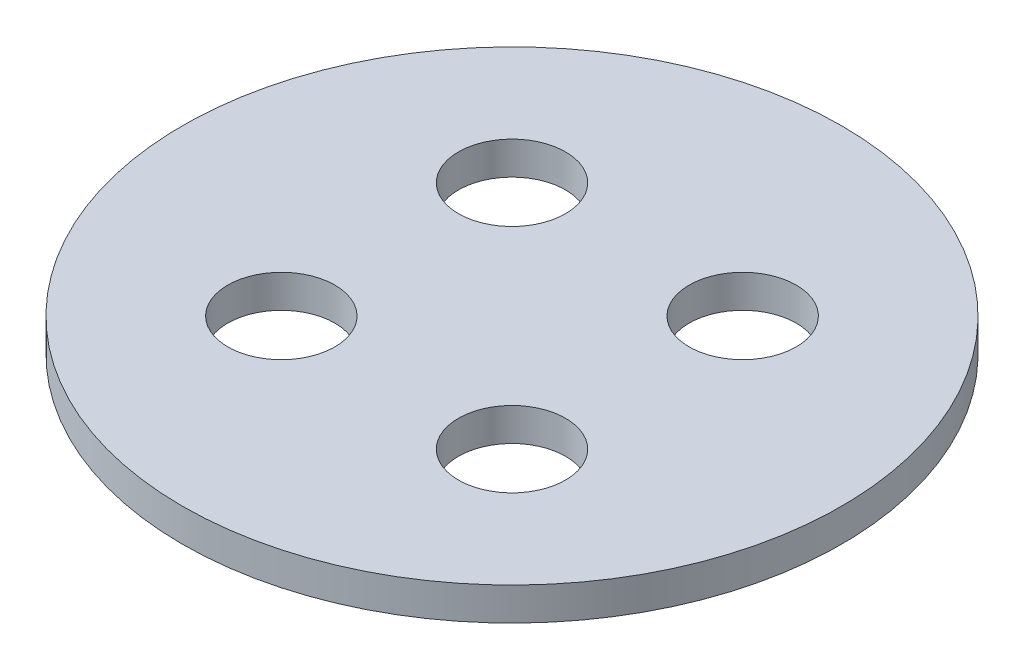
from build123d import *

# Parameters (mm, degrees)
SKETCH1_R           = 20
SKETCH1_R_2         = 3.25
BOSS_EXTRUDE1_DEPTH = 2


with BuildPart() as part:
    # Sketch1 → Boss-Extrude1 (new body)
    with BuildSketch(Plane(origin=(0, 0, 0), x_dir=(1, 0, 0), z_dir=(0, 1, 0))):
        with Locations(Location((0, 0, 0), (0, 0, 270))):
            Circle(SKETCH1_R)
        with Locations(Location((-7, 7, 0), (0, 0, 270))):
            Circle(SKETCH1_R_2, mode=Mode.SUBTRACT)
        with Locations(Location((7, 7, 0), (0, 0, 90))):
            Circle(SKETCH1_R_2, mode=Mode.SUBTRACT)
        with Locations(Location((7, -7, 0), (0, 0, 270))):
            Circle(SKETCH1_R_2, mode=Mode.SUBTRACT)
        with Locations(Location((-7, -7, 0), (0, 0, 90))):
            Circle(SKETCH1_R_2, mode=Mode.SUBTRACT)
    extrude(amount=BOSS_EXTRUDE1_DEPTH)


solid = part.part
